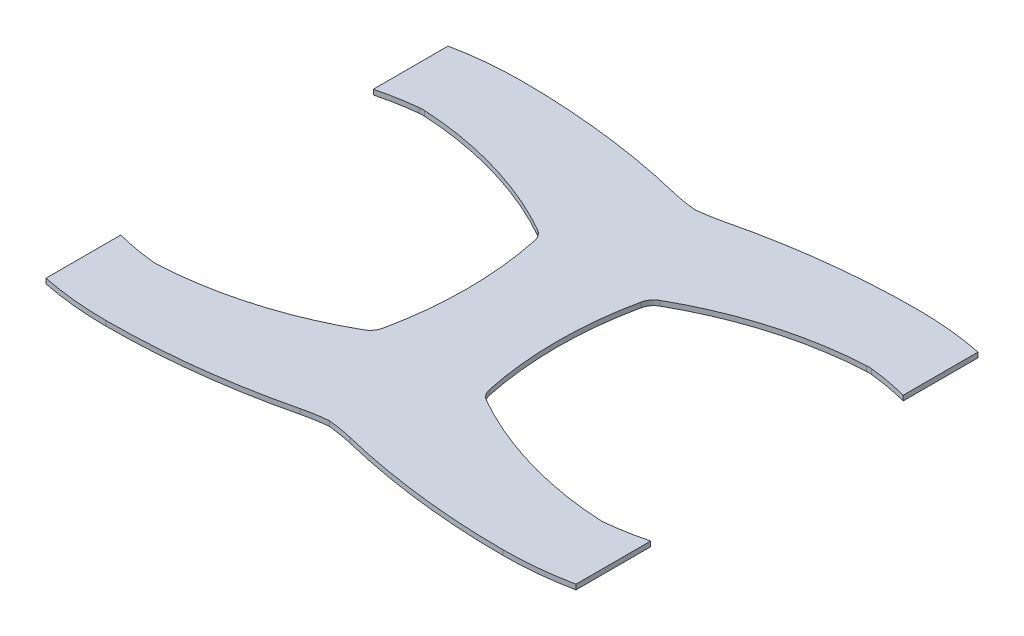
from build123d import *

# Parameters (mm, degrees)
BOSS_EXTRUDE1_START = -10
BOSS_EXTRUDE1_DEPTH = 3


with BuildPart() as part:
    # Sketch1 → Boss-Extrude1 (new body)
    with BuildSketch(Plane(origin=(0, 0, 0), x_dir=(1, 0, 0), z_dir=(0, 1, 0)).offset(BOSS_EXTRUDE1_START)):
        with BuildLine():
            Line((319, 246), (319, 201))
            ThreePointArc((319, 201), (307.388484736, 203.573435825), (295.616405389, 205.2669548))
            ThreePointArc((295.616405389, 205.2669548), (294.01464809, 205.37142016), (292.409672101, 205.347098762))
            ThreePointArc((292.409672101, 205.347098762), (242.780979678, 196.828732334), (196.389162845, 177.248921069))
            ThreePointArc((196.389162845, 177.248921069), (193.242585284, 174.455386906), (191.523683958, 170.614792982))
            ThreePointArc((191.523683958, 170.614792982), (186.742852856, 125), (191.523683958, 79.385207018))
            ThreePointArc((191.523683958, 79.385207018), (193.242585284, 75.544613094), (196.389162845, 72.751078931))
            ThreePointArc((196.389162845, 72.751078931), (242.780979678, 53.171267666), (292.409672101, 44.652901238))
            ThreePointArc((292.409672101, 44.652901238), (294.01464809, 44.62857984), (295.616405389, 44.7330452))
            ThreePointArc((295.616405389, 44.7330452), (307.388484736, 46.426564175), (319, 49))
            Line((319, 49), (319, 4))
            ThreePointArc((319, 4), (299.099751242, 1.002487578), (279, 0))
            ThreePointArc((279, 0), (226.377523813, 3.136099081), (174.5, 12.5))
            ThreePointArc((174.5, 12.5), (167.04561677, 14.023700621), (159.5, 15))
            ThreePointArc((159.5, 15), (151.95438323, 14.023700621), (144.5, 12.5))
            ThreePointArc((144.5, 12.5), (92.622476187, 3.136099081), (40, 0))
            ThreePointArc((40, 0), (19.900248758, 1.002487578), (0, 4))
            Line((0, 4), (0, 49))
            ThreePointArc((0, 49), (11.611515264, 46.426564175), (23.383594611, 44.7330452))
            ThreePointArc((23.383594611, 44.7330452), (24.98535191, 44.62857984), (26.590327899, 44.652901238))
            ThreePointArc((26.590327899, 44.652901238), (76.219020322, 53.171267666), (122.610837155, 72.751078931))
            ThreePointArc((122.610837155, 72.751078931), (125.757414716, 75.544613094), (127.476316042, 79.385207018))
            ThreePointArc((127.476316042, 79.385207018), (132.257147144, 125), (127.476316042, 170.614792982))
            ThreePointArc((127.476316042, 170.614792982), (125.757414716, 174.455386906), (122.610837155, 177.248921069))
            ThreePointArc((122.610837155, 177.248921069), (76.219020322, 196.828732334), (26.590327899, 205.347098762))
            ThreePointArc((26.590327899, 205.347098762), (24.98535191, 205.37142016), (23.383594611, 205.2669548))
            ThreePointArc((23.383594611, 205.2669548), (11.611515264, 203.573435825), (0, 201))
            Line((0, 201), (0, 246))
            ThreePointArc((0, 246), (19.900248758, 248.997512422), (40, 250))
            ThreePointArc((40, 250), (92.622476187, 246.863900919), (144.5, 237.5))
            ThreePointArc((144.5, 237.5), (151.95438323, 235.976299379), (159.5, 235))
            ThreePointArc((159.5, 235), (167.04561677, 235.976299379), (174.5, 237.5))
            ThreePointArc((174.5, 237.5), (226.377523813, 246.863900919), (279, 250))
            ThreePointArc((279, 250), (299.099751242, 248.997512422), (319, 246))
        make_face()
    extrude(amount=-BOSS_EXTRUDE1_DEPTH)


solid = part.part
